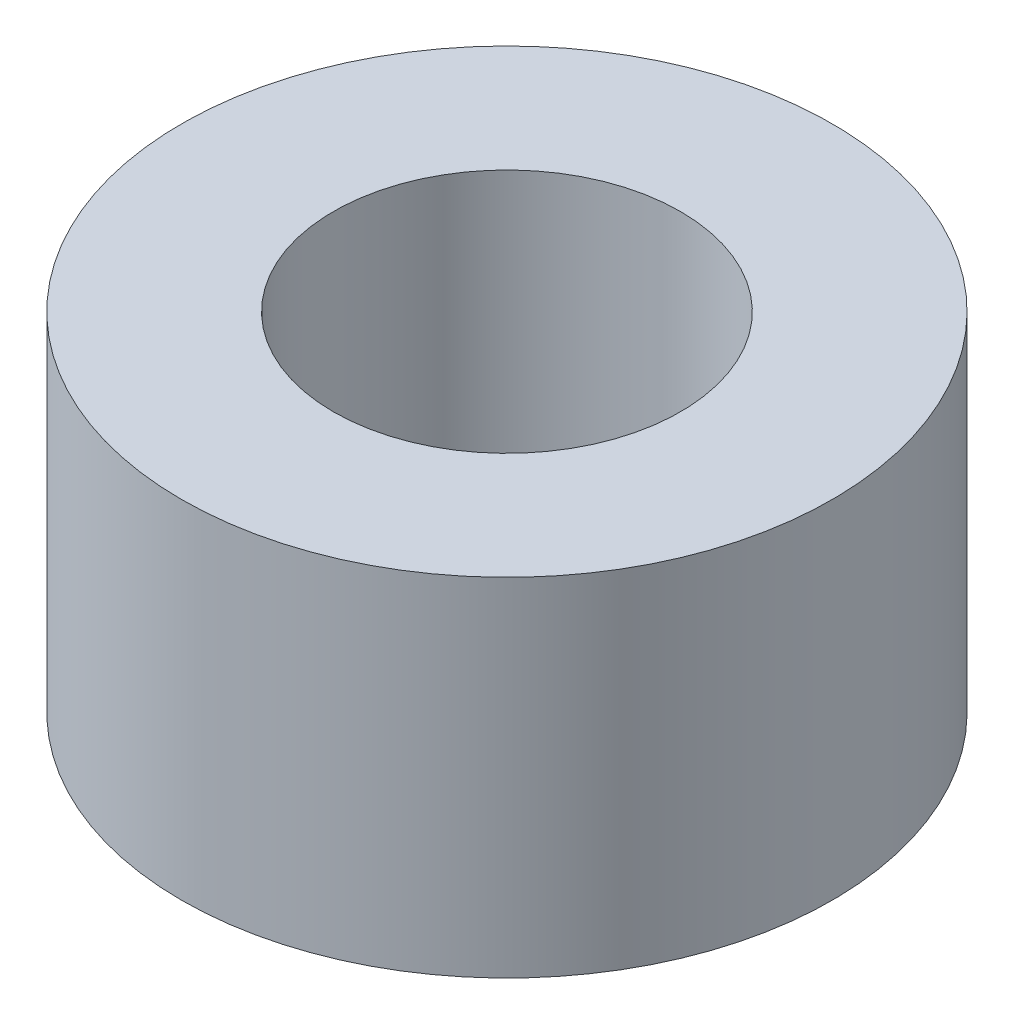
from build123d import *

# Parameters (mm, degrees)
SKETCH1_R           = 11.90625
SKETCH1_R_2         = 6.35
BOSS_EXTRUDE1_DEPTH = 12.7


with BuildPart() as part:
    # Sketch1 → Boss-Extrude1 (new body)
    with BuildSketch(Plane(origin=(0, 0, 0), x_dir=(1, 0, 0), z_dir=(0, 1, 0))):
        with Locations(Location((0, 0, 0), (0, 0, 270))):
            Circle(SKETCH1_R)
        with Locations(Location((0, 0, 0), (0, 0, 270))):
            Circle(SKETCH1_R_2, mode=Mode.SUBTRACT)
    extrude(amount=BOSS_EXTRUDE1_DEPTH)


solid = part.part
